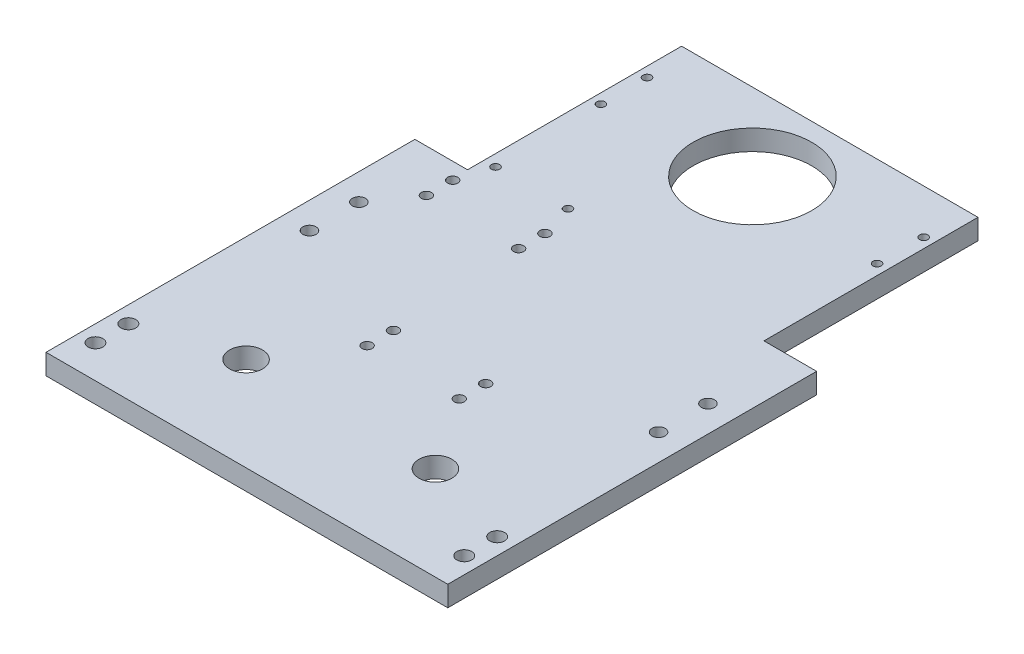
from build123d import *

# Parameters (mm, degrees)
SKETCH1_W           = 122
SKETCH1_H           = 112
BOSS_EXTRUDE1_DEPTH = 6.2
SKETCH2_W           = 90
SKETCH2_H           = 65
BOSS_EXTRUDE2_DEPTH = 6.2
SKETCH3_R           = 1.25
SKETCH3_R_2         = 18
CUT_EXTRUDE1_DEPTH  = 136.648221514
SKETCH4_R           = 1.55
CUT_EXTRUDE2_DEPTH  = 136.648221514
SKETCH5_R           = 2
CUT_EXTRUDE3_DEPTH  = 10
SKETCH6_R           = 5
CUT_EXTRUDE4_DEPTH  = 10
SKETCH7_R           = 2.25
CUT_EXTRUDE5_DEPTH  = 136.648221514


with BuildPart() as part:
    # Sketch1 → Boss-Extrude1 (new body)
    with BuildSketch(Plane(origin=(0, 0, 0), x_dir=(1, 0, 0), z_dir=(0, 1, 0))):
        Rectangle(SKETCH1_W, SKETCH1_H)
    extrude(amount=BOSS_EXTRUDE1_DEPTH)

    # Sketch2 → Boss-Extrude2 (add)
    with BuildSketch(Plane(origin=(0, 0, 0), x_dir=(1, 0, 0), z_dir=(0, 1, 0))):
        with Locations((0, 88.5)):
            Rectangle(SKETCH2_W, SKETCH2_H)
    extrude(amount=BOSS_EXTRUDE2_DEPTH)

    # Sketch3 → Cut-Extrude1 (cut, through all)
    with BuildSketch(Plane(origin=(0, 6.2, 0), x_dir=(1, 0, 0), z_dir=(0, 1, 0))):
        with Locations(Location((-41.5, 61, 0), (0, 0, 270))):
            Circle(SKETCH3_R)
        with Locations(Location((-19.5, 61, 0), (0, 0, 270))):
            Circle(SKETCH3_R)
        with Locations(Location((-42, 93.5, 0), (0, 0, 270))):
            Circle(SKETCH3_R)
        with Locations(Location((-42, 107.5, 0), (0, 0, 270))):
            Circle(SKETCH3_R)
        with Locations(Location((42, 107.5, 0), (0, 0, 270))):
            Circle(SKETCH3_R)
        with Locations(Location((41.859469925, 93.5, 0), (0, 0, 270))):
            Circle(SKETCH3_R)
        with Locations(Location((0, 97.5, 0), (0, 0, 270))):
            Circle(SKETCH3_R_2)
    extrude(amount=-CUT_EXTRUDE1_DEPTH, mode=Mode.SUBTRACT)

    # Sketch4 → Cut-Extrude2 (cut, through all)
    with BuildSketch(Plane(origin=(0, 6.2, 0), x_dir=(1, 0, 0), z_dir=(0, 1, 0))):
        with Locations(Location((-44.5, 51, 0), (0, 0, 270))):
            Circle(SKETCH4_R)
        with Locations(Location((-16.5, 51, 0), (0, 0, 270))):
            Circle(SKETCH4_R)
        with Locations(Location((-16.5, 43, 0), (0, 0, 270))):
            Circle(SKETCH4_R)
        with Locations(Location((-44.5, 43, 0), (0, 0, 270))):
            Circle(SKETCH4_R)
        with Locations(Location((-14, 2.5, 0), (0, 0, 270))):
            Circle(SKETCH4_R)
        with Locations(Location((14, 2.5, 0), (0, 0, 270))):
            Circle(SKETCH4_R)
        with Locations(Location((14, -5.5, 0), (0, 0, 270))):
            Circle(SKETCH4_R)
        with Locations(Location((-14, -5.5, 0), (0, 0, 270))):
            Circle(SKETCH4_R)
    extrude(amount=-CUT_EXTRUDE2_DEPTH, mode=Mode.SUBTRACT)

    # Sketch5 → Cut-Extrude3 (cut)
    with BuildSketch(Plane(origin=(0, 6.2, 0), x_dir=(1, 0, 0), z_dir=(0, 1, 0))):
        with Locations(Location((-53, 31, 0), (0, 0, 270))):
            Circle(SKETCH5_R)
        with Locations(Location((-53, 16, 0), (0, 0, 270))):
            Circle(SKETCH5_R)
        with Locations(Location((53, 16, 0), (0, 0, 270))):
            Circle(SKETCH5_R)
        with Locations(Location((53, 31, 0), (0, 0, 270))):
            Circle(SKETCH5_R)
    extrude(amount=-CUT_EXTRUDE3_DEPTH, mode=Mode.SUBTRACT)

    # Sketch6 → Cut-Extrude4 (cut)
    with BuildSketch(Plane(origin=(0, 6.2, 0), x_dir=(1, 0, 0), z_dir=(0, 1, 0))):
        with Locations(Location((-28.75, -27.5, 0), (0, 0, 270))):
            Circle(SKETCH6_R)
        with Locations(Location((28.75, -27.5, 0), (0, 0, 270))):
            Circle(SKETCH6_R)
    extrude(amount=-CUT_EXTRUDE4_DEPTH, mode=Mode.SUBTRACT)

    # Sketch7 → Cut-Extrude5 (cut, through all)
    with BuildSketch(Plane(origin=(0, 6.2, 0), x_dir=(1, 0, 0), z_dir=(0, 1, 0))):
        with Locations(Location((-56, -36, 0), (0, 0, 270))):
            Circle(SKETCH7_R)
        with Locations(Location((-56, -46, 0), (0, 0, 270))):
            Circle(SKETCH7_R)
        with Locations(Location((56, -46, 0), (0, 0, 270))):
            Circle(SKETCH7_R)
        with Locations(Location((56, -36, 0), (0, 0, 270))):
            Circle(SKETCH7_R)
    extrude(amount=-CUT_EXTRUDE5_DEPTH, mode=Mode.SUBTRACT)


solid = part.part
